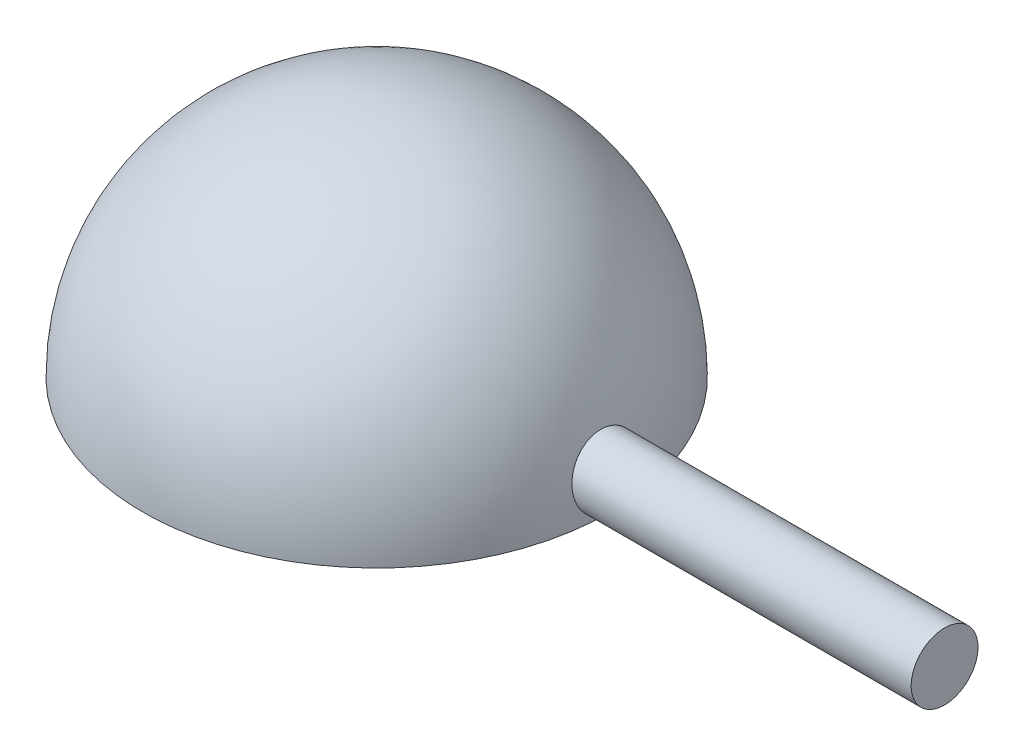
from build123d import *

# Parameters (mm, degrees)
CIRKEL_R                   = 5
ARM_DEPTH                  = 50
ARM_DIRECTION_2_REACH      = 87.732
ARM_DIRECTION_2_END_RADIUS = 35


with BuildPart() as part:
    # boog → bol_half (revolve)
    with BuildSketch(Plane.XY):
        with BuildLine():
            Line((-35, 0), (-33, 0))
            ThreePointArc((-33, 0), (-23.334523779, 23.334523779), (0, 33))
            Line((0, 33), (0, 35))
            ThreePointArc((0, 35), (-24.748737342, 24.748737342), (-35, 0))
        make_face()
    revolve(axis=Axis((0, 0, 0), (0, 1, 0)))

    # cirkel → arm (add)
    with BuildSketch(Plane(origin=(35, 0, 0), x_dir=(0, 0, -1), z_dir=(1, 0, 0))):
        with Locations((0, 5)):
            Circle(CIRKEL_R)
    extrude(amount=ARM_DEPTH)

    # arm direction 2: up to this sphere (the profile starts outside it)
    arm_direction_2_end = Location((0, 0, 0)) * Sphere(ARM_DIRECTION_2_END_RADIUS, mode=Mode.PRIVATE)
    # cirkel → arm direction 2 (add, up to the surface)
    with BuildSketch(Plane(origin=(35, 0, 0), x_dir=(0, 0, -1), z_dir=(1, 0, 0)), mode=Mode.PRIVATE) as arm_direction_2_sk1:
        with Locations((0, 5)):
            Circle(CIRKEL_R)
    arm_direction_2_tool1 = extrude(arm_direction_2_sk1.sketch, amount=-ARM_DIRECTION_2_REACH, mode=Mode.PRIVATE) - arm_direction_2_end
    add(arm_direction_2_tool1.solids().sort_by_distance((35, 5, 0))[0])


solid = part.part
